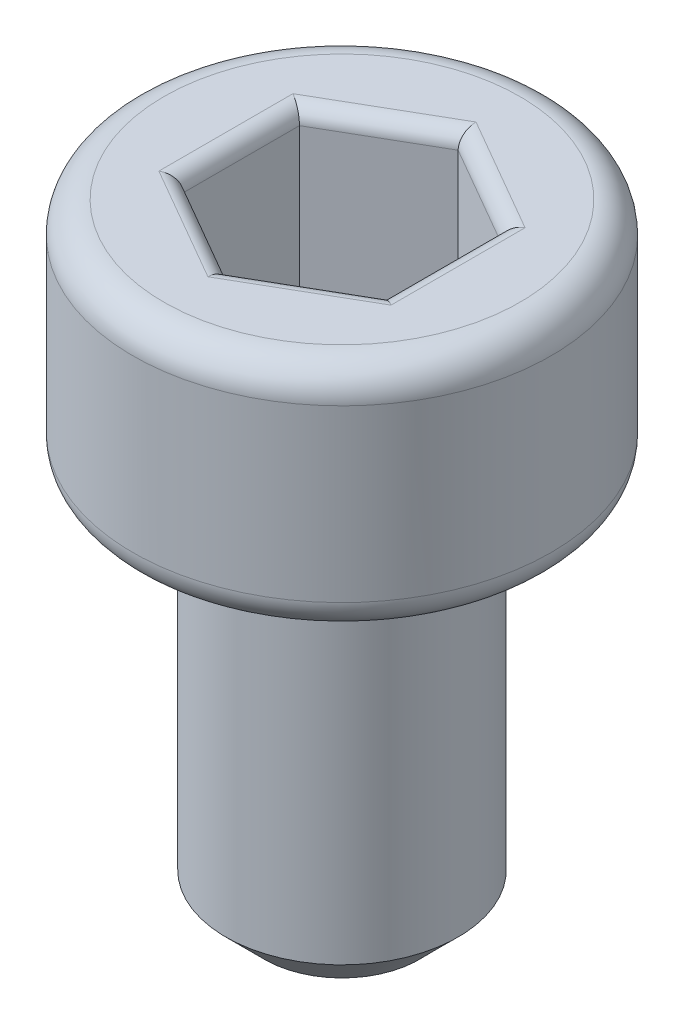
from build123d import *

# Parameters (mm, degrees)
SCHNITT_LINEAR_AUSTRAGEN1_DEPTH = 2
VERRUNDUNG1_R                   = 0.4
VERRUNDUNG2_R                   = 0.2


with BuildPart() as part:
    # Skizze1 → Rotation1 (revolve)
    with BuildSketch(Plane.XY):
        Polygon((0, 0), (0, -8), (-1, -8), (-1.5, -7.5), (-1.5, -3), (-2.7, -3), (-2.7, 0), align=None)
    revolve(axis=Axis((0, 0, 0), (0, -1, 0)))

    # Skizze2 → Schnitt-Linear austragen1 (cut)
    with BuildSketch(Plane(origin=(0, 0, 0), x_dir=(1, 0, 0), z_dir=(0, 1, 0))):
        Polygon((1.299038106, 0.75), (1.299038106, -0.75), (0, -1.5), (-1.299038106, -0.75), (-1.299038106, 0.75), (0, 1.5), align=None)
    extrude(amount=-SCHNITT_LINEAR_AUSTRAGEN1_DEPTH, mode=Mode.SUBTRACT)

    # Verrundung1
    verrundung1_edges = [part.edges().sort_by_distance(p)[0] for p in [
        (2.7, 0, 0),
        (2.7, -3, 0),
    ]]
    fillet(verrundung1_edges, radius=VERRUNDUNG1_R)

    # Verrundung2
    verrundung2_edges = [part.edges().sort_by_distance(p)[0] for p in [
        (0.649519053, 0, -1.125),
        (-0.649519053, 0, -1.125),
        (-1.299038106, 0, 0),
        (-0.649519053, 0, 1.125),
        (0.649519053, 0, 1.125),
        (1.299038106, 0, 0),
    ]]
    fillet(verrundung2_edges, radius=VERRUNDUNG2_R)


solid = part.part
